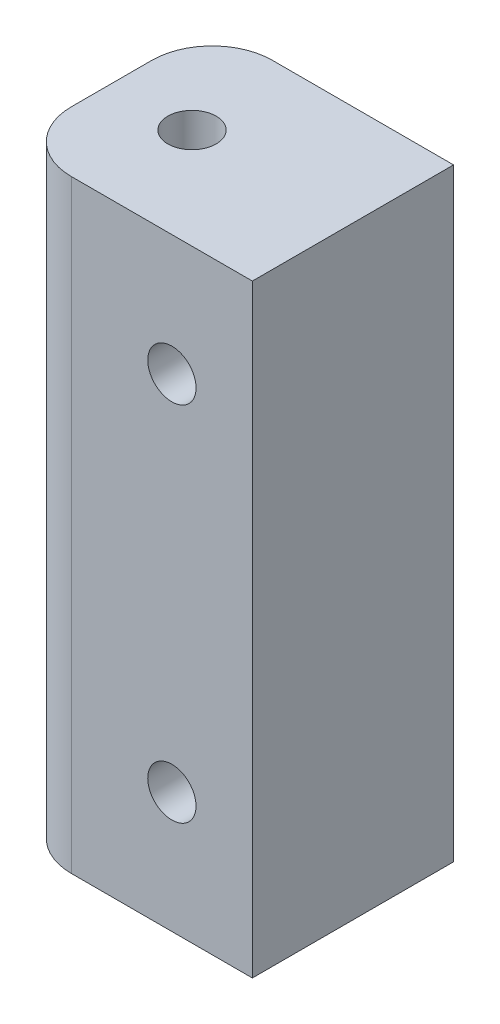
from build123d import *

# Parameters (mm, degrees)
ESQUISSE1_W             = 12
ESQUISSE1_H             = 10
ESQUISSE1_R             = 1.2
BOSS_EXTRU_1_DEPTH      = 15
ESQUISSE2_R             = 1.2
ENL_V_MAT_EXTRU_1_DEPTH = 20
CONG_1_R                = 3


with BuildPart() as part:
    # Esquisse1 → Boss.-Extru.1 (new, symmetric)
    with BuildSketch(Plane(origin=(0, 0, 0), x_dir=(1, 0, 0), z_dir=(0, 1, 0))):
        with Locations((0, 5)):
            Rectangle(ESQUISSE1_W, ESQUISSE1_H)
        with Locations(Location((-2, 5, 0), (0, 0, 270))):
            Circle(ESQUISSE1_R, mode=Mode.SUBTRACT)
    extrude(amount=BOSS_EXTRU_1_DEPTH, both=True)

    # Esquisse2 → Enlèv. mat.-Extru.1 (cut, through all)
    with BuildSketch(Plane.XY):
        with Locations((2, 9)):
            Circle(ESQUISSE2_R)
        with Locations(Location((2, -9, 0), (0, 0, 180))):
            Circle(ESQUISSE2_R)
    extrude(amount=-ENL_V_MAT_EXTRU_1_DEPTH, mode=Mode.SUBTRACT)

    # Congé1
    cong_1_edges = [part.edges().sort_by_distance(p)[0] for p in [
        (-6, 0, -10),
        (-6, 0, 0),
    ]]
    fillet(cong_1_edges, radius=CONG_1_R)


solid = part.part
